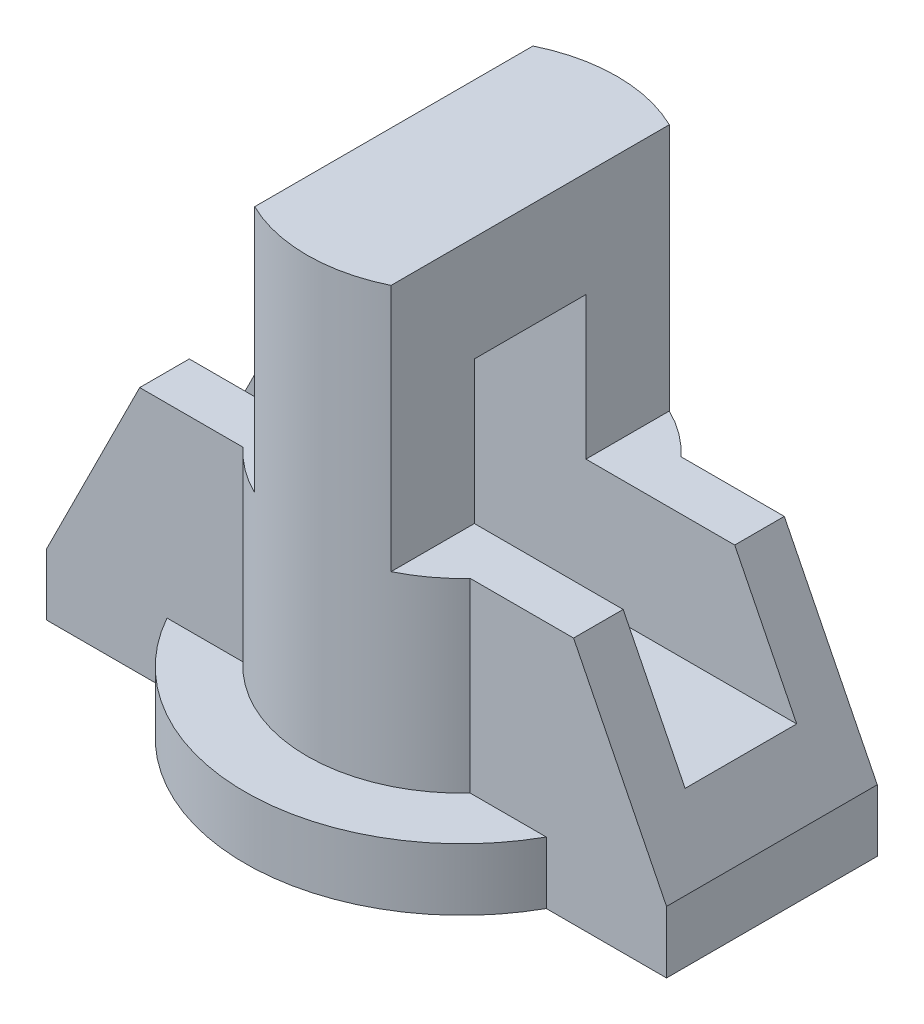
from build123d import *

# Parameters (mm, degrees)
BOSS_EXTRUDE2_DEPTH = 80
BOSS_EXTRUDE3_DEPTH = 10
BOSS_EXTRUDE4_DEPTH = 40
CUT_EXTRUDE1_DEPTH  = 108.721864076
SKETCH3_W           = 18
SKETCH3_H           = 43
CUT_EXTRUDE2_DEPTH  = 133.759180474


with BuildPart() as part:
    # Sketch1 → Boss-Extrude2 (new body)
    with BuildSketch(Plane(origin=(0, 0, 0), x_dir=(1, 0, 0), z_dir=(0, 1, 0))):
        with BuildLine():
            Line((11, 17), (11, 22.449944321))
            ThreePointArc((11, 22.449944321), (0, 25), (-11, 22.449944321))
            Line((-11, 22.449944321), (-11, 17))
            Line((-11, 17), (-11, 9))
            Line((-11, 9), (-11, -9))
            Line((-11, -9), (-11, -17))
            Line((-11, -17), (-11, -22.449944321))
            ThreePointArc((-11, -22.449944321), (0, -25), (11, -22.449944321))
            Line((11, -22.449944321), (11, -17))
            Line((11, -17), (11, -9))
            Line((11, -9), (11, 9))
            Line((11, 9), (11, 17))
        make_face()
    extrude(amount=BOSS_EXTRUDE2_DEPTH)

    # Sketch1<6> → Boss-Extrude3 (add)
    with BuildSketch(Plane(origin=(0, 0, 0), x_dir=(1, 0, 0), z_dir=(0, 1, 0))):
        with BuildLine():
            ThreePointArc((-18.33030278, 17), (0, 25), (18.33030278, 17))
            Line((18.33030278, 17), (30.594117082, 17))
            ThreePointArc((30.594117082, 17), (0, 35), (-30.594117082, 17))
            Line((-30.594117082, 17), (-18.33030278, 17))
        make_face()
        with BuildLine():
            ThreePointArc((18.33030278, -17), (0, -25), (-18.33030278, -17))
            Line((-18.33030278, -17), (-30.594117082, -17))
            ThreePointArc((-30.594117082, -17), (0, -35), (30.594117082, -17))
            Line((30.594117082, -17), (18.33030278, -17))
        make_face()
    extrude(amount=BOSS_EXTRUDE3_DEPTH)

    # Sketch1<9> → Boss-Extrude4 (add)
    with BuildSketch(Plane(origin=(0, 0, 0), x_dir=(1, 0, 0), z_dir=(0, 1, 0))):
        with BuildLine():
            ThreePointArc((18.33030278, 17), (14.916170372, 20.062598571), (11, 22.449944321))
            Line((11, 22.449944321), (11, -22.449944321))
            ThreePointArc((11, -22.449944321), (14.916170372, -20.062598571), (18.33030278, -17))
            Line((18.33030278, -17), (50, -17))
            Line((50, -17), (50, 17))
            Line((50, 17), (18.33030278, 17))
        make_face()
        with BuildLine():
            ThreePointArc((-11, 22.449944321), (-14.916170372, 20.062598571), (-18.33030278, 17))
            Line((-18.33030278, 17), (-50, 17))
            Line((-50, 17), (-50, -17))
            Line((-50, -17), (-18.33030278, -17))
            ThreePointArc((-18.33030278, -17), (-14.916170372, -20.062598571), (-11, -22.449944321))
            Line((-11, -22.449944321), (-11, 22.449944321))
        make_face()
    extrude(amount=BOSS_EXTRUDE4_DEPTH)

    # Sketch2 → Cut-Extrude1 (cut, through all)
    with BuildSketch(Plane.XY.offset(17)):
        Polygon((-50, 10), (-35, 40), (-50, 40), align=None)
        Polygon((50, 10), (35, 40), (50, 40), align=None)
    extrude(amount=-CUT_EXTRUDE1_DEPTH, mode=Mode.SUBTRACT)

    # Sketch3 → Cut-Extrude2 (cut, through all)
    with BuildSketch(Plane.ZY.offset(50)):
        with Locations((0, 41.5)):
            Rectangle(SKETCH3_W, SKETCH3_H)
    extrude(amount=-CUT_EXTRUDE2_DEPTH, mode=Mode.SUBTRACT)


solid = part.part
